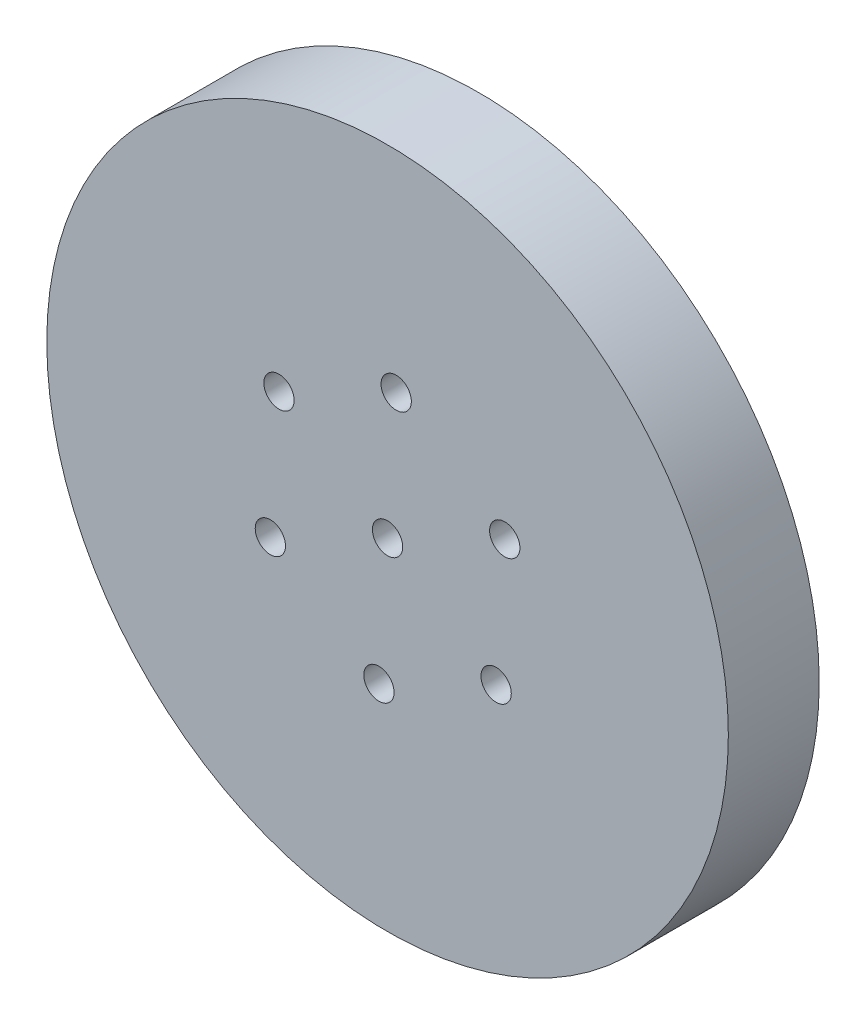
from build123d import *

# Parameters (mm, degrees)
SKETCH_1_R          = 45
EXTRUDE_1_DEPTH     = 12
SKETCH_5_R          = 2
CUT_EXTRUDE_1_DEPTH = 20
SKETCH_6_R          = 2
CUT_EXTRUDE_2_DEPTH = 21


with BuildPart() as part:
    # 草图1 → 凸台-拉伸1 (new body)
    with BuildSketch(Plane.XY):
        Circle(SKETCH_1_R)
    extrude(amount=EXTRUDE_1_DEPTH)

    # 草图5 → 切除-拉伸1 (cut)
    with BuildSketch(Plane(origin=(0, 0, 0), x_dir=(-1, 0, 0), z_dir=(0, 0, -1))):
        with Locations((-15.476254719, 7.618926425)):
            Circle(SKETCH_5_R)
        with Locations((-1.139943526, 17.212292955)):
            Circle(SKETCH_5_R)
        with Locations((14.336311193, 9.59336653)):
            Circle(SKETCH_5_R)
        with Locations((15.476254719, -7.618926425)):
            Circle(SKETCH_5_R)
        with Locations((1.139943526, -17.212292955)):
            Circle(SKETCH_5_R)
        with Locations((-14.336311193, -9.59336653)):
            Circle(SKETCH_5_R)
    extrude(amount=-CUT_EXTRUDE_1_DEPTH, mode=Mode.SUBTRACT)

    # 草图6 → 切除-拉伸2 (cut)
    with BuildSketch(Plane(origin=(0, 0, 0), x_dir=(-1, 0, 0), z_dir=(0, 0, -1))):
        Circle(SKETCH_6_R)
    extrude(amount=-CUT_EXTRUDE_2_DEPTH, mode=Mode.SUBTRACT)


solid = part.part
